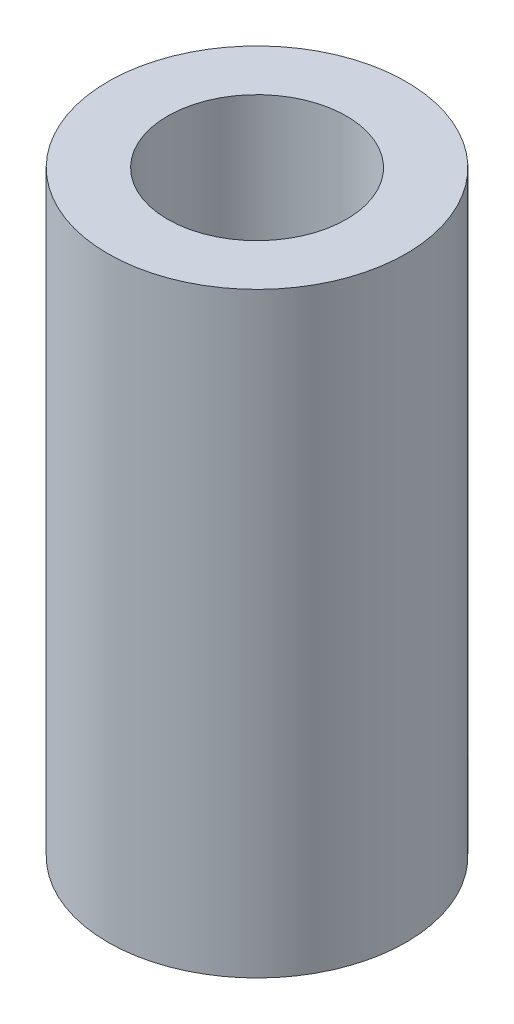
from build123d import *

# Parameters (mm, degrees)
SKETCH1_R           = 2.5
BOSS_EXTRUDE1_DEPTH = 10
SKETCH2_R           = 1.5
CUT_EXTRUDE1_DEPTH  = 16


with BuildPart() as part:
    # Sketch1 → Boss-Extrude1 (new body)
    with BuildSketch(Plane(origin=(0, 0, 0), x_dir=(1, 0, 0), z_dir=(0, 1, 0))):
        with Locations(Location((0, 0, 0), (0, 0, 270))):
            Circle(SKETCH1_R)
    extrude(amount=BOSS_EXTRUDE1_DEPTH)

    # Sketch2 → Cut-Extrude1 (cut)
    with BuildSketch(Plane(origin=(0, 10, 0), x_dir=(1, 0, 0), z_dir=(0, 1, 0))):
        with Locations(Location((0, 0, 0), (0, 0, 270))):
            Circle(SKETCH2_R)
    extrude(amount=-CUT_EXTRUDE1_DEPTH, mode=Mode.SUBTRACT)


solid = part.part
